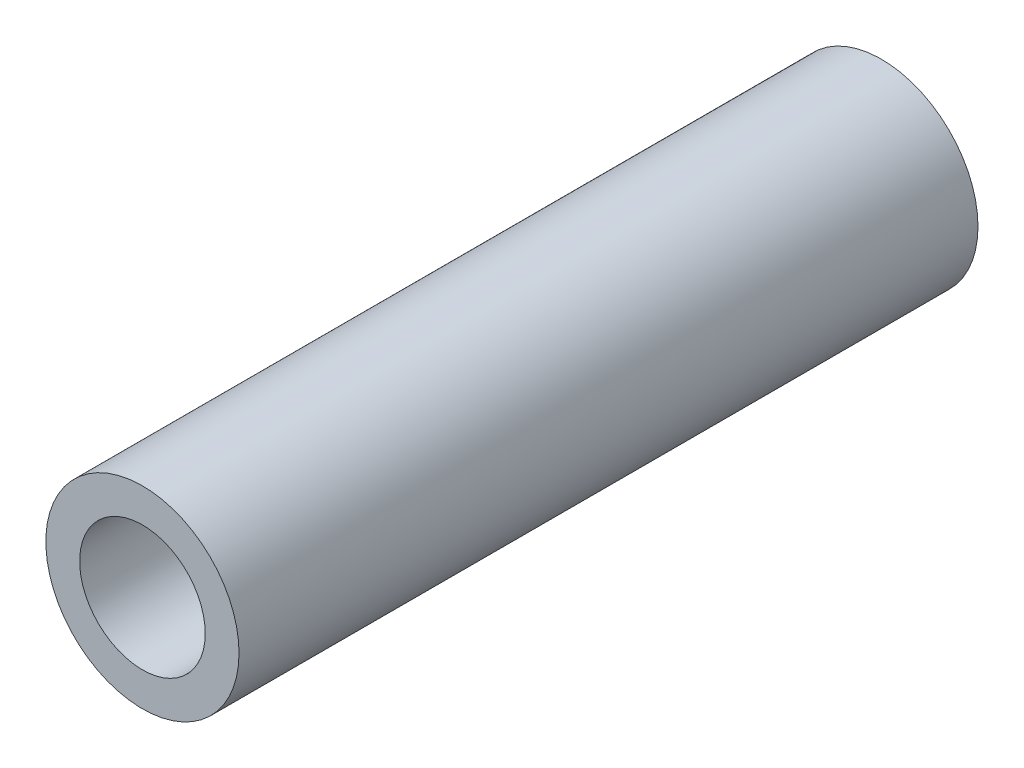
from build123d import *

# Parameters (mm, degrees)
SKETCH1_R           = 2
BOSS_EXTRUDE1_DEPTH = 15.3
SKETCH2_R           = 1.3
CUT_EXTRUDE1_DEPTH  = 16.559241627


with BuildPart() as part:
    # Sketch1 → Boss-Extrude1 (new body)
    with BuildSketch(Plane.XY):
        Circle(SKETCH1_R)
    extrude(amount=-BOSS_EXTRUDE1_DEPTH)

    # Sketch2 → Cut-Extrude1 (cut, through all)
    with BuildSketch(Plane.XY):
        Circle(SKETCH2_R)
    extrude(amount=-CUT_EXTRUDE1_DEPTH, mode=Mode.SUBTRACT)


solid = part.part
